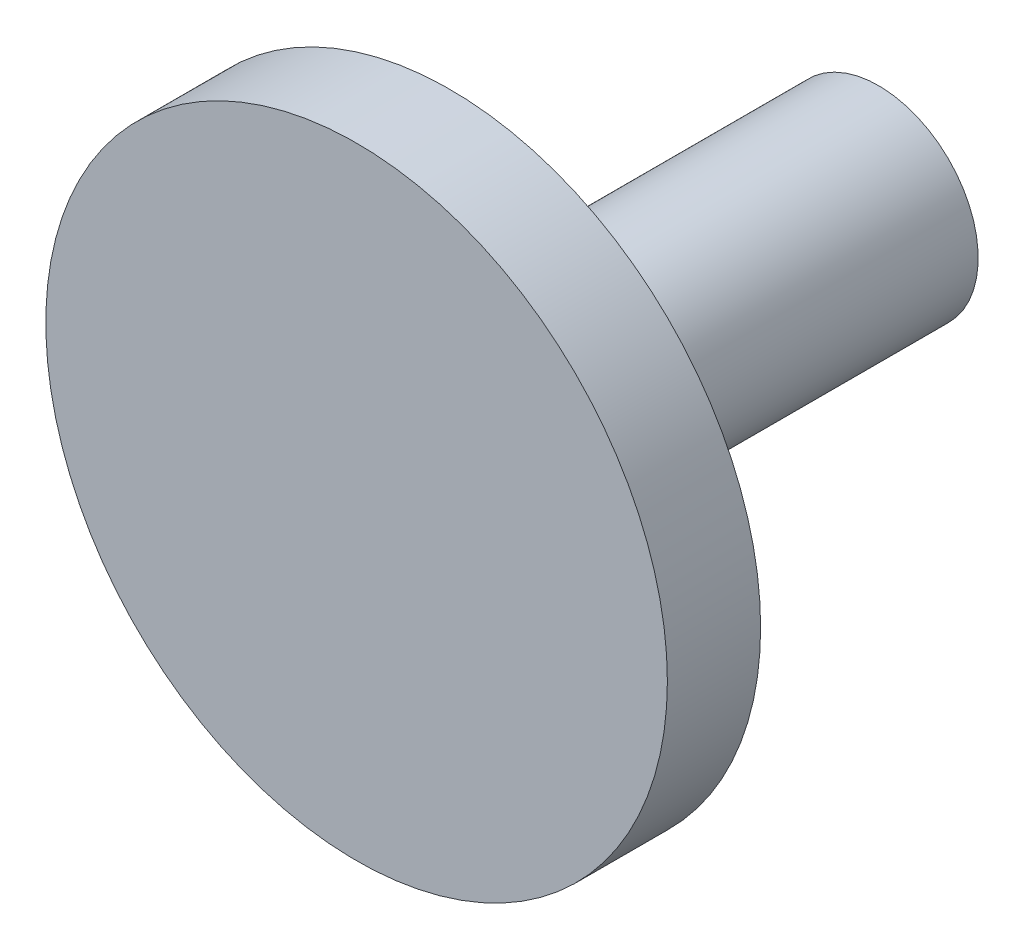
from build123d import *

# Parameters (mm, degrees)
ESBO_O1_R                = 1.6
RESSALTO_EXTRUS_O1_DEPTH = 6.9
ESBO_O3_R                = 5
RESSALTO_EXTRUS_O2_DEPTH = 1.5


with BuildPart() as part:
    # Esboço1 → Ressalto-extrusão1 (new body)
    with BuildSketch(Plane.XY):
        with Locations(Location((0, 0, 0), (0, 0, 180))):
            Circle(ESBO_O1_R)
    extrude(amount=RESSALTO_EXTRUS_O1_DEPTH)

    # Esboço3 → Ressalto-extrusão2 (add)
    with BuildSketch(Plane.XY.offset(6.9)):
        Circle(ESBO_O3_R)
    extrude(amount=RESSALTO_EXTRUS_O2_DEPTH)


solid = part.part
